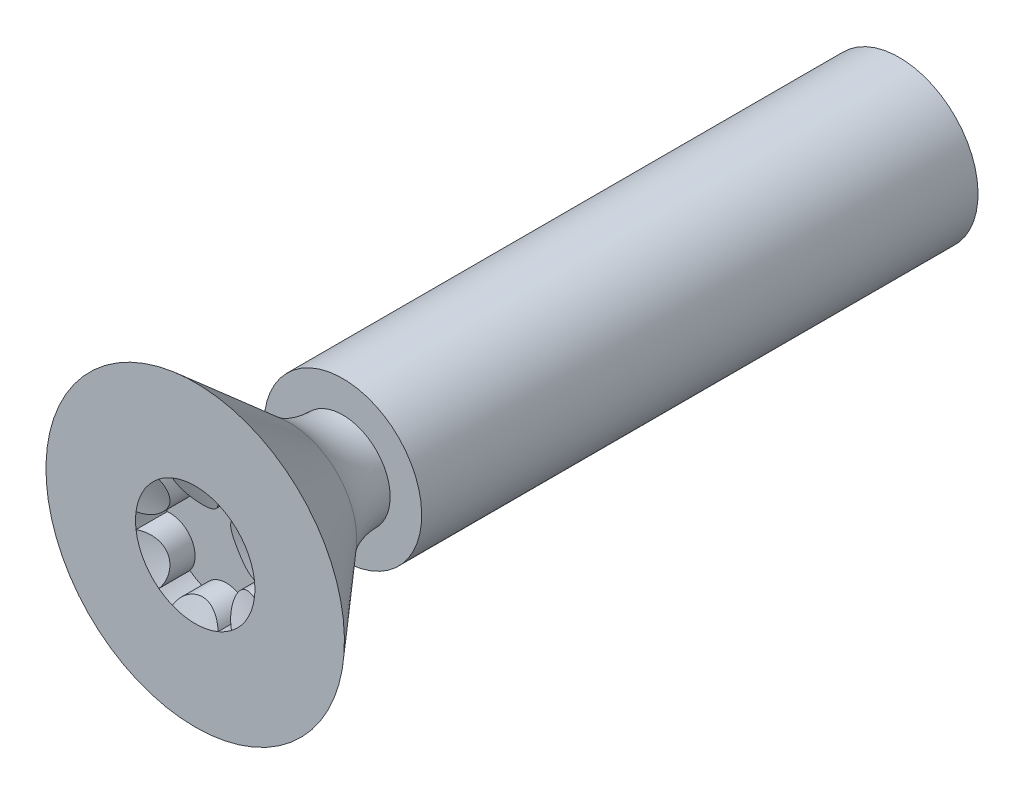
from build123d import *

# Parameters (mm, degrees)
CUT_EXTRUDE14_DEPTH = 0.561594
CIRPATTERN1_COUNT   = 6


with BuildPart() as part:
    # Sketch3 → Revolve1 (revolve)
    with BuildSketch(Plane(origin=(0, 0, 0), x_dir=(0, 0, -1), z_dir=(1, 0, 0)), mode=Mode.PRIVATE) as revolve1_sk:
        with BuildLine():
            Line((-3.68638517, 1.4224), (-3.68638517, 0.85344))
            ThreePointArc((-3.68638517, 0.85344), (-4.199806429, 0.946281688), (-4.6482, 1.21304783))
            Line((-4.6482, 1.21304783), (-6.35, 2.6924))
            Line((-6.35, 2.6924), (-6.35, 0))
            Line((-6.35, 0), (6.35, 0))
            Line((6.35, 0), (6.35, 1.4224))
            Line((6.35, 1.4224), (-3.68638517, 1.4224))
        make_face()
    revolve(revolve1_sk.sketch.rotate(Axis((0, 0, 6.35), (0, 0, -1)), 180), axis=Axis((0, 0, 6.35), (0, 0, -1)))

    # Sketch21 → Cut-Extrude14 (cut)
    with BuildSketch(Plane.XY.offset(6.35)):
        with BuildLine():
            Line((0, 0), (-0.53848, 0.932674719))
            ThreePointArc((-0.53848, 0.932674719), (-0.476327228, 0.965896068), (-0.412134749, 0.994981301))
            ThreePointArc((-0.412134749, 0.994981301), (0, 0.719601666), (0.412134749, 0.994981301))
            ThreePointArc((0.412134749, 0.994981301), (0.476327228, 0.965896068), (0.53848, 0.932674719))
            Line((0.53848, 0.932674719), (0, 0))
        make_face()
    cut_extrude14 = extrude(amount=-CUT_EXTRUDE14_DEPTH, mode=Mode.SUBTRACT)

    # CirPattern1: Cut-Extrude14 ×6 about axis
    cirpattern1_axis = Axis((0, 0, 0), (0, 0, 1))
    for i in range(1, CIRPATTERN1_COUNT):
        add(cut_extrude14.rotate(cirpattern1_axis, i * 360 / CIRPATTERN1_COUNT), mode=Mode.SUBTRACT)

    # Cut-Extrude15 cone 1 section (through the dimple's axis) → Cut-Extrude15 (revolve, cut)
    with BuildSketch(Plane(origin=(0, 0, 6.35), x_dir=(0, -1, 0), z_dir=(1, 0, 0))):
        Polygon((0, 0), (1.07696, 0), (0, 0.391981383), align=None)
    revolve(axis=Axis((0, 0, 6.35), (0, 0, -1)), mode=Mode.SUBTRACT)


solid = part.part
